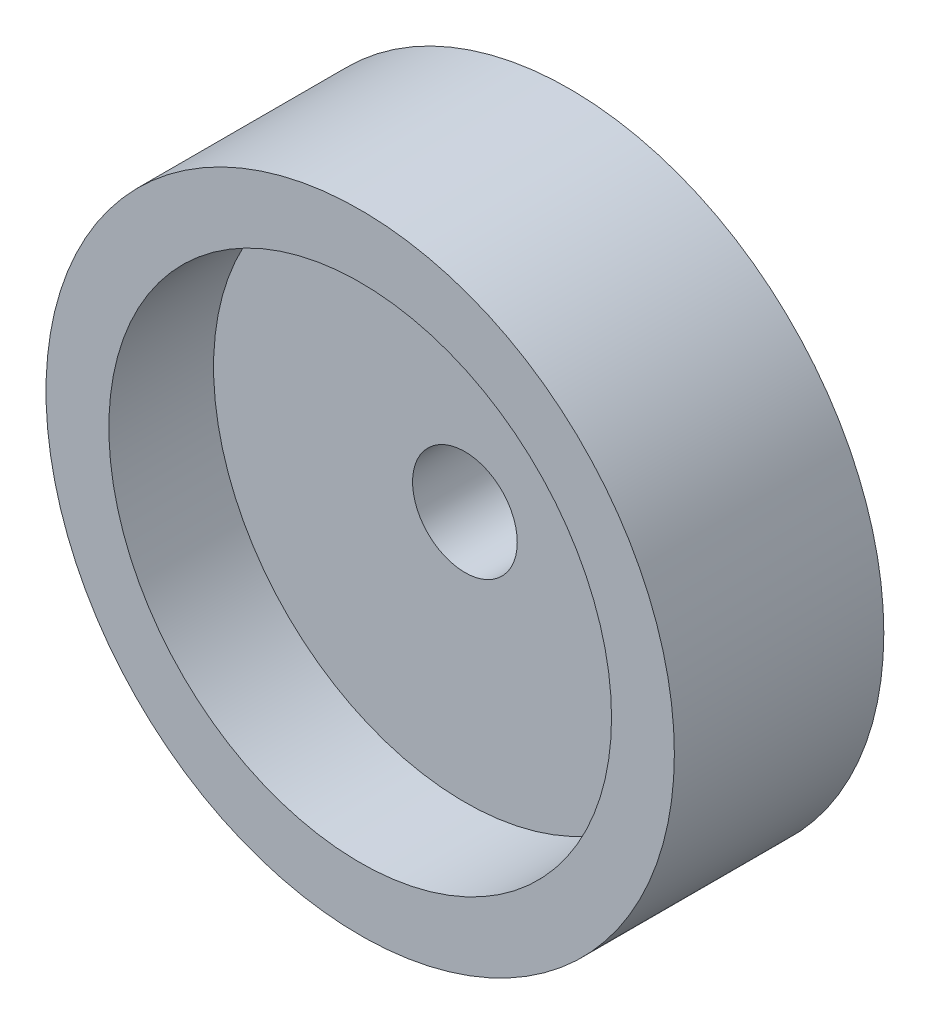
from build123d import *

# Parameters (mm, degrees)
SKETCH2_R           = 7.62
SKETCH2_R_2         = 1.5875
BOSS_EXTRUDE1_DEPTH = 3.175
SKETCH2_4_R         = 9.525
SKETCH2_4_R_2       = 7.62
BOSS_EXTRUDE3_DEPTH = 6.35


with BuildPart() as part:
    # Sketch2 → Boss-Extrude1 (new body)
    with BuildSketch(Plane.XY):
        Circle(SKETCH2_R)
        Circle(SKETCH2_R_2, mode=Mode.SUBTRACT)
    extrude(amount=BOSS_EXTRUDE1_DEPTH)

    # Sketch2<4> → Boss-Extrude3 (add)
    with BuildSketch(Plane.XY):
        Circle(SKETCH2_4_R)
        Circle(SKETCH2_4_R_2, mode=Mode.SUBTRACT)
    extrude(amount=BOSS_EXTRUDE3_DEPTH)


solid = part.part
